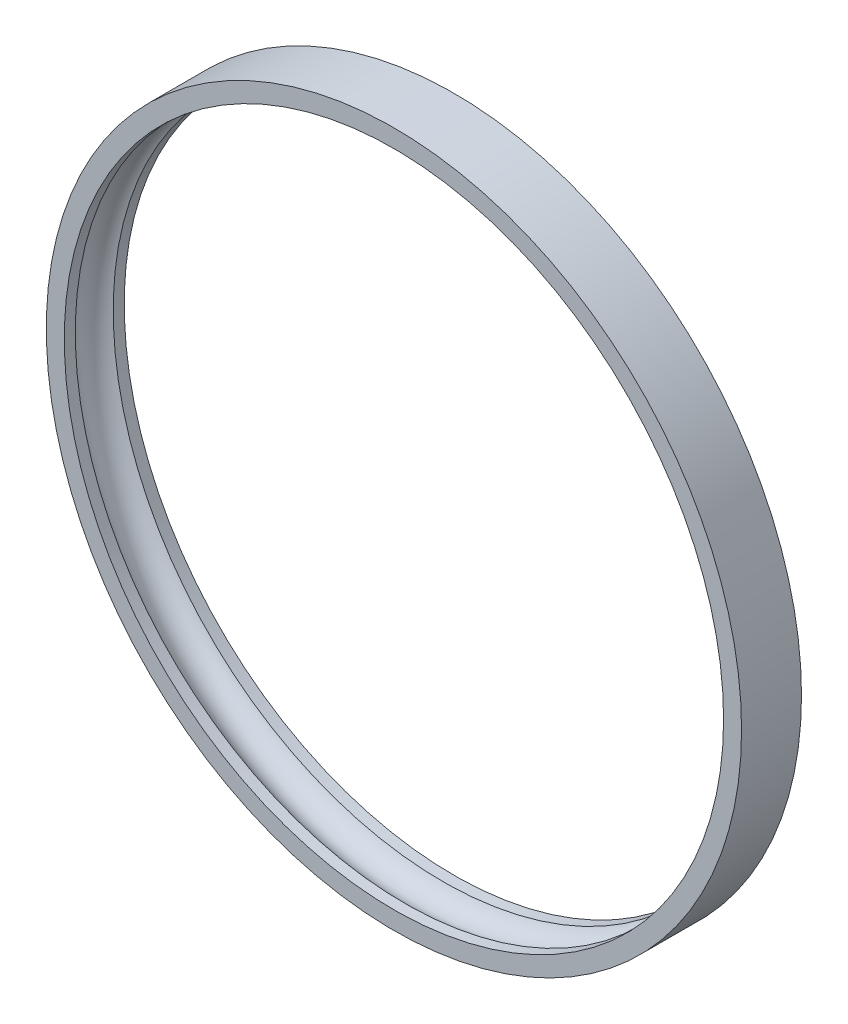
from build123d import *


with BuildPart() as part:
    # Sketch2 → Revolve2 (revolve)
    with BuildSketch(Plane(origin=(0, 0, 0), x_dir=(0, 0, -1), z_dir=(1, 0, 0)), mode=Mode.PRIVATE) as revolve2_sk:
        with BuildLine():
            Line((-10, 6), (10, 6))
            Line((10, 6), (10, 0))
            Line((10, 0), (6.32455532, 0))
            ThreePointArc((6.32455532, 0), (0, 4), (-6.32455532, 0))
            Line((-6.32455532, 0), (-10, 0))
            Line((-10, 0), (-10, 6))
        make_face()
    revolve(revolve2_sk.sketch.rotate(Axis((0, -110, 0), (0, 0, -1)), 90), axis=Axis((0, -110, 0), (0, 0, -1)))


solid = part.part
